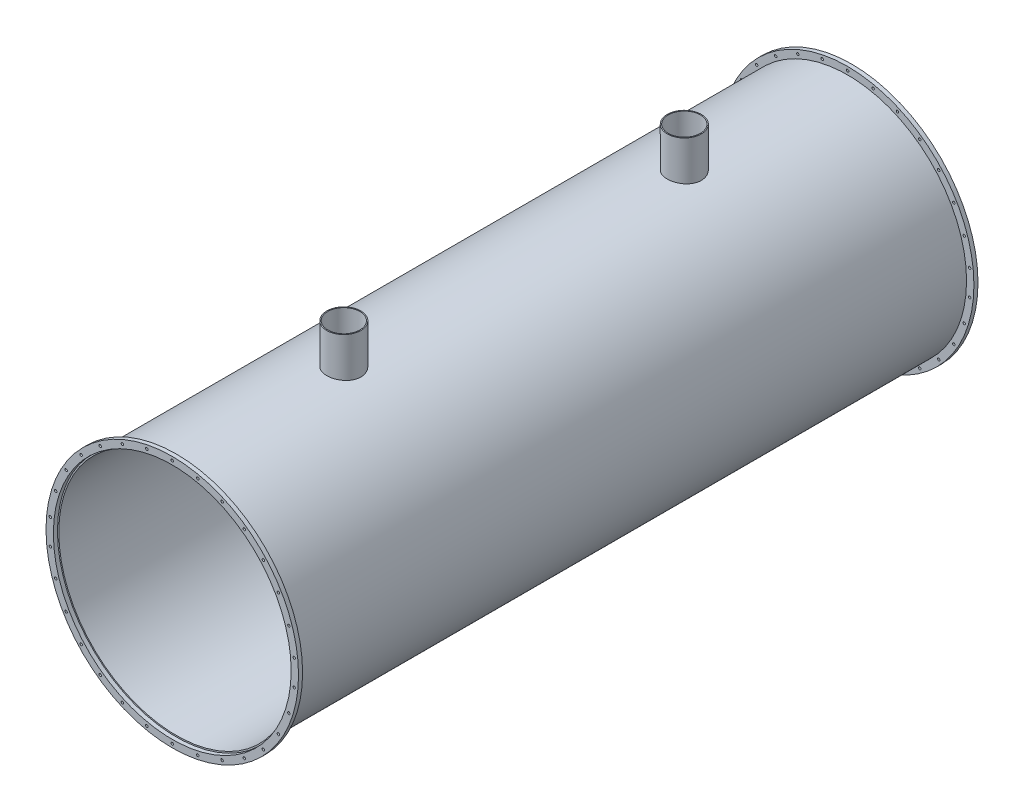
from build123d import *

# Parameters (mm, degrees)
SKETCH1_R                = 2130.025
SKETCH1_R_2              = 2105.58
BOSS_EXTRUDE1_DEPTH      = 12100
BOSS_EXTRUDE2_REACH      = 13251.494
BOSS_EXTRUDE2_END_RADIUS = 2130.025
SKETCH2_R                = 304.8
SKETCH3_R                = 287.4
CUT_EXTRUDE1_DEPTH       = 1000
SKETCH4_R                = 2262.0235
SKETCH4_R_2              = 2130.025
BOSS_EXTRUDE3_DEPTH      = 73
SKETCH5_R                = 22
CUT_EXTRUDE2_DEPTH       = 73
SKETCH6_R                = 2262.0235
SKETCH6_R_2              = 2130.025
BOSS_EXTRUDE4_DEPTH      = 73
SKETCH7_R                = 22
CUT_EXTRUDE3_DEPTH       = 73


with BuildPart() as part:
    # Sketch1 → Boss-Extrude1 (new body)
    with BuildSketch(Plane.XY):
        Circle(SKETCH1_R)
        Circle(SKETCH1_R_2, mode=Mode.SUBTRACT)
    extrude(amount=BOSS_EXTRUDE1_DEPTH)

    # Boss-Extrude2: up to this cylinder (the profile starts outside it)
    boss_extrude2_end = Plane(origin=(0, 0, 6050), z_dir=(0, 0, -1)) * Cylinder(BOSS_EXTRUDE2_END_RADIUS, 36864.038, mode=Mode.PRIVATE)
    # Sketch2 → Boss-Extrude2 (add, up to the surface)
    with BuildSketch(Plane(origin=(0, 2830.0235, 0), x_dir=(1, 0, 0), z_dir=(0, 1, 0)), mode=Mode.PRIVATE) as boss_extrude2_sk1:
        with Locations(Location((0, -3000, 0), (0, 0, 270))):
            Circle(SKETCH2_R)
    boss_extrude2_tool1 = extrude(boss_extrude2_sk1.sketch, amount=-BOSS_EXTRUDE2_REACH, mode=Mode.PRIVATE) - boss_extrude2_end
    add(boss_extrude2_tool1.solids().sort_by_distance((0, 2830.0235, 3000))[0])
    # Sketch2 → Boss-Extrude2 (add, up to the surface)
    with BuildSketch(Plane(origin=(0, 2830.0235, 0), x_dir=(1, 0, 0), z_dir=(0, 1, 0)), mode=Mode.PRIVATE) as boss_extrude2_sk2:
        with Locations(Location((0, -9100, 0), (0, 0, 270))):
            Circle(SKETCH2_R)
    boss_extrude2_tool2 = extrude(boss_extrude2_sk2.sketch, amount=-BOSS_EXTRUDE2_REACH, mode=Mode.PRIVATE) - boss_extrude2_end
    add(boss_extrude2_tool2.solids().sort_by_distance((0, 2830.0235, 9100))[0])

    # Sketch3 → Cut-Extrude1 (cut)
    with BuildSketch(Plane(origin=(0, 2830.0235, 0), x_dir=(1, 0, 0), z_dir=(0, 1, 0))):
        with Locations(Location((0, -3000, 0), (0, 0, 270))):
            Circle(SKETCH3_R)
        with Locations(Location((0, -9100, 0), (0, 0, 270))):
            Circle(SKETCH3_R)
    extrude(amount=-CUT_EXTRUDE1_DEPTH, mode=Mode.SUBTRACT)

    # Sketch6 → Boss-Extrude4 (add)
    with BuildSketch(Plane(origin=(0, 0, 0), x_dir=(-1, 0, 0), z_dir=(0, 0, -1))):
        with Locations(Location((0, 0, 0), (0, 0, 180))):
            Circle(SKETCH6_R)
        with Locations(Location((0, 0, 0), (0, 0, 180))):
            Circle(SKETCH6_R_2, mode=Mode.SUBTRACT)
    extrude(amount=-BOSS_EXTRUDE4_DEPTH)

    # Sketch7 → Cut-Extrude3 (cut)
    with BuildSketch(Plane(origin=(0, 0, 0), x_dir=(-1, 0, 0), z_dir=(0, 0, -1))):
        with Locations(Location((-1631.964615369, 1469.427539829, 0), (0, 0, 180))):
            Circle(SKETCH7_R)
        with Locations(Location((-1290.791108666, 1776.621545072, 0), (0, 0, 180))):
            Circle(SKETCH7_R)
        with Locations(Location((-893.203836611, 2006.16866362, 0), (0, 0, 180))):
            Circle(SKETCH7_R)
        with Locations(Location((-456.579270828, 2148.036584901, 0), (0, 0, 180))):
            Circle(SKETCH7_R)
        with Locations(Location((0, 2196.025, 0), (0, 0, 180))):
            Circle(SKETCH7_R)
        with Locations(Location((-1290.791108666, -1776.621545072, 0), (0, 0, 180))):
            Circle(SKETCH7_R)
        with Locations(Location((-1631.964615369, -1469.427539829, 0), (0, 0, 180))):
            Circle(SKETCH7_R)
        with Locations(Location((-1901.813437346, -1098.0125, 0), (0, 0, 180))):
            Circle(SKETCH7_R)
        with Locations(Location((-2088.543886197, -678.609045072, 0), (0, 0, 180))):
            Circle(SKETCH7_R)
        with Locations(Location((-2183.994945276, -229.547118547, 0), (0, 0, 180))):
            Circle(SKETCH7_R)
        with Locations(Location((-2183.994945276, 229.547118547, 0), (0, 0, 180))):
            Circle(SKETCH7_R)
        with Locations(Location((-2088.543886197, 678.609045072, 0), (0, 0, 180))):
            Circle(SKETCH7_R)
        with Locations(Location((-1901.813437346, 1098.0125, 0), (0, 0, 180))):
            Circle(SKETCH7_R)
        with Locations(Location((1901.813437346, -1098.0125, 0), (0, 0, 180))):
            Circle(SKETCH7_R)
        with Locations(Location((1631.964615369, -1469.427539829, 0), (0, 0, 180))):
            Circle(SKETCH7_R)
        with Locations(Location((1290.791108665, -1776.621545072, 0), (0, 0, 180))):
            Circle(SKETCH7_R)
        with Locations(Location((893.20383661, -2006.16866362, 0), (0, 0, 180))):
            Circle(SKETCH7_R)
        with Locations(Location((456.579270828, -2148.036584901, 0), (0, 0, 180))):
            Circle(SKETCH7_R)
        with Locations(Location((0, -2196.025, 0), (0, 0, 180))):
            Circle(SKETCH7_R)
        with Locations(Location((-456.579270828, -2148.036584901, 0), (0, 0, 180))):
            Circle(SKETCH7_R)
        with Locations(Location((-893.203836611, -2006.16866362, 0), (0, 0, 180))):
            Circle(SKETCH7_R)
        with Locations(Location((893.203836611, 2006.16866362, 0), (0, 0, 180))):
            Circle(SKETCH7_R)
        with Locations(Location((1290.791108666, 1776.621545072, 0), (0, 0, 180))):
            Circle(SKETCH7_R)
        with Locations(Location((1631.964615369, 1469.427539829, 0), (0, 0, 180))):
            Circle(SKETCH7_R)
        with Locations(Location((1901.813437346, 1098.0125, 0), (0, 0, 180))):
            Circle(SKETCH7_R)
        with Locations(Location((2088.543886197, 678.609045072, 0), (0, 0, 180))):
            Circle(SKETCH7_R)
        with Locations(Location((2183.994945276, 229.547118547, 0), (0, 0, 180))):
            Circle(SKETCH7_R)
        with Locations(Location((2183.994945276, -229.547118547, 0), (0, 0, 180))):
            Circle(SKETCH7_R)
        with Locations(Location((2088.543886197, -678.609045072, 0), (0, 0, 180))):
            Circle(SKETCH7_R)
        with Locations(Location((456.579270828, 2148.036584901, 0), (0, 0, 180))):
            Circle(SKETCH7_R)
    extrude(amount=-CUT_EXTRUDE3_DEPTH, mode=Mode.SUBTRACT)


with BuildPart() as body_2:
    # Sketch4 → Boss-Extrude3 (new body)
    with BuildSketch(Plane.XY.offset(12100)):
        Circle(SKETCH4_R)
        Circle(SKETCH4_R_2, mode=Mode.SUBTRACT)
    extrude(amount=BOSS_EXTRUDE3_DEPTH)

    # Sketch5 → Cut-Extrude2 (cut)
    with BuildSketch(Plane.XY.offset(12173)):
        with Locations((0, 2196.025)):
            Circle(SKETCH5_R)
        with Locations((456.579270828, 2148.036584901)):
            Circle(SKETCH5_R)
        with Locations((893.203836611, 2006.16866362)):
            Circle(SKETCH5_R)
        with Locations((1290.791108666, 1776.621545072)):
            Circle(SKETCH5_R)
        with Locations((1631.964615369, 1469.427539829)):
            Circle(SKETCH5_R)
        with Locations((1901.813437346, 1098.0125)):
            Circle(SKETCH5_R)
        with Locations((2088.543886197, 678.609045072)):
            Circle(SKETCH5_R)
        with Locations((2183.994945276, 229.547118547)):
            Circle(SKETCH5_R)
        with Locations((2183.994945276, -229.547118547)):
            Circle(SKETCH5_R)
        with Locations((2088.543886197, -678.609045072)):
            Circle(SKETCH5_R)
        with Locations((1901.813437346, -1098.0125)):
            Circle(SKETCH5_R)
        with Locations((1631.964615369, -1469.427539829)):
            Circle(SKETCH5_R)
        with Locations((1290.791108666, -1776.621545072)):
            Circle(SKETCH5_R)
        with Locations((893.203836611, -2006.16866362)):
            Circle(SKETCH5_R)
        with Locations((456.579270828, -2148.036584901)):
            Circle(SKETCH5_R)
        with Locations((0, -2196.025)):
            Circle(SKETCH5_R)
        with Locations((-456.579270828, -2148.036584901)):
            Circle(SKETCH5_R)
        with Locations((-893.20383661, -2006.16866362)):
            Circle(SKETCH5_R)
        with Locations((-1290.791108665, -1776.621545072)):
            Circle(SKETCH5_R)
        with Locations((-1631.964615369, -1469.427539829)):
            Circle(SKETCH5_R)
        with Locations((-1901.813437346, -1098.0125)):
            Circle(SKETCH5_R)
        with Locations((-2088.543886197, -678.609045072)):
            Circle(SKETCH5_R)
        with Locations((-2183.994945276, -229.547118547)):
            Circle(SKETCH5_R)
        with Locations((-2183.994945276, 229.547118547)):
            Circle(SKETCH5_R)
        with Locations((-2088.543886197, 678.609045072)):
            Circle(SKETCH5_R)
        with Locations((-1901.813437346, 1098.0125)):
            Circle(SKETCH5_R)
        with Locations((-1631.964615369, 1469.427539829)):
            Circle(SKETCH5_R)
        with Locations((-1290.791108666, 1776.621545072)):
            Circle(SKETCH5_R)
        with Locations((-893.203836611, 2006.16866362)):
            Circle(SKETCH5_R)
        with Locations((-456.579270828, 2148.036584901)):
            Circle(SKETCH5_R)
    extrude(amount=-CUT_EXTRUDE2_DEPTH, mode=Mode.SUBTRACT)


solid = Compound([part.part, body_2.part])
